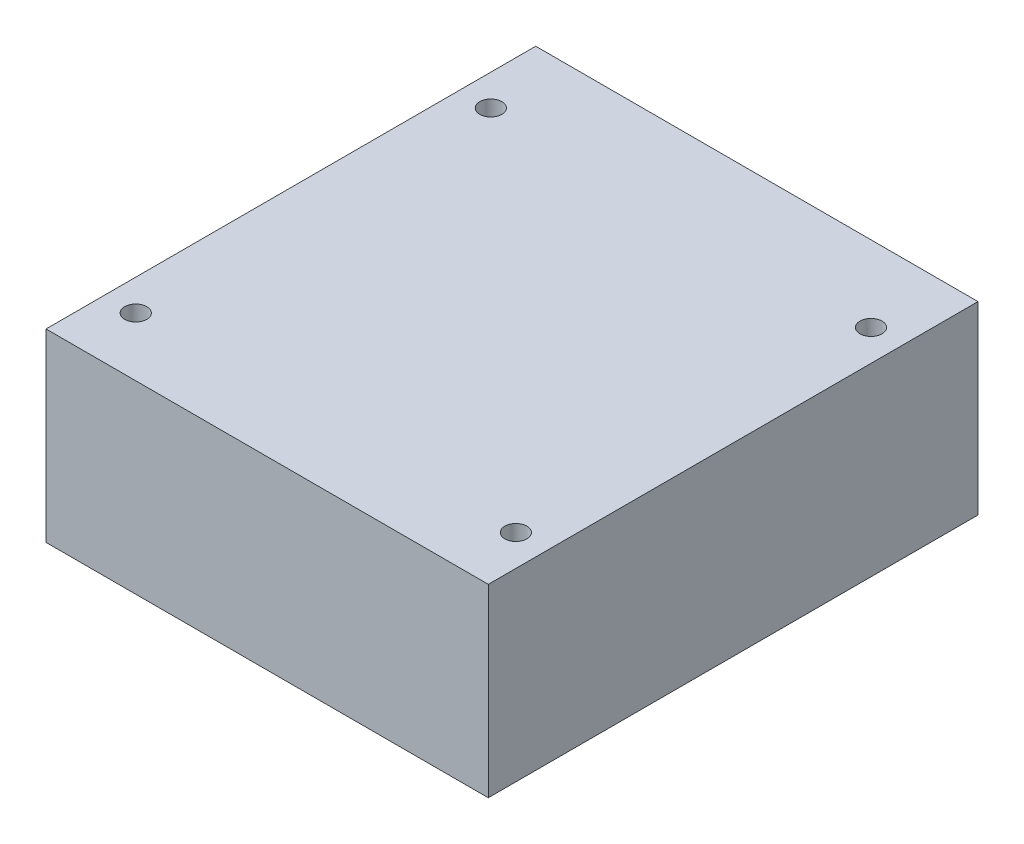
from build123d import *

# Parameters (mm, degrees)
SKETCH1_W           = 64.07
SKETCH1_H           = 70.94
BOSS_EXTRUDE1_DEPTH = 26.78
SKETCH4_R           = 1.6
CUT_EXTRUDE1_DEPTH  = 55.786225687


with BuildPart() as part:
    # Sketch1 → Boss-Extrude1 (new body)
    with BuildSketch(Plane(origin=(0, 0, 0), x_dir=(1, 0, 0), z_dir=(0, 1, 0))):
        Rectangle(SKETCH1_W, SKETCH1_H)
    extrude(amount=BOSS_EXTRUDE1_DEPTH)

    # Sketch4 → Cut-Extrude1 (cut, through all)
    with BuildSketch(Plane(origin=(0, 26.78, 0), x_dir=(1, 0, 0), z_dir=(0, 1, 0))):
        with Locations(Location((-27.535, 24.47, 0), (0, 0, 270))):
            Circle(SKETCH4_R)
        with Locations(Location((27.535, 24.47, 0), (0, 0, 270))):
            Circle(SKETCH4_R)
        with Locations(Location((-27.535, -26.97, 0), (0, 0, 270))):
            Circle(SKETCH4_R)
        with Locations(Location((27.535, -26.97, 0), (0, 0, 270))):
            Circle(SKETCH4_R)
    extrude(amount=-CUT_EXTRUDE1_DEPTH, mode=Mode.SUBTRACT)


solid = part.part
